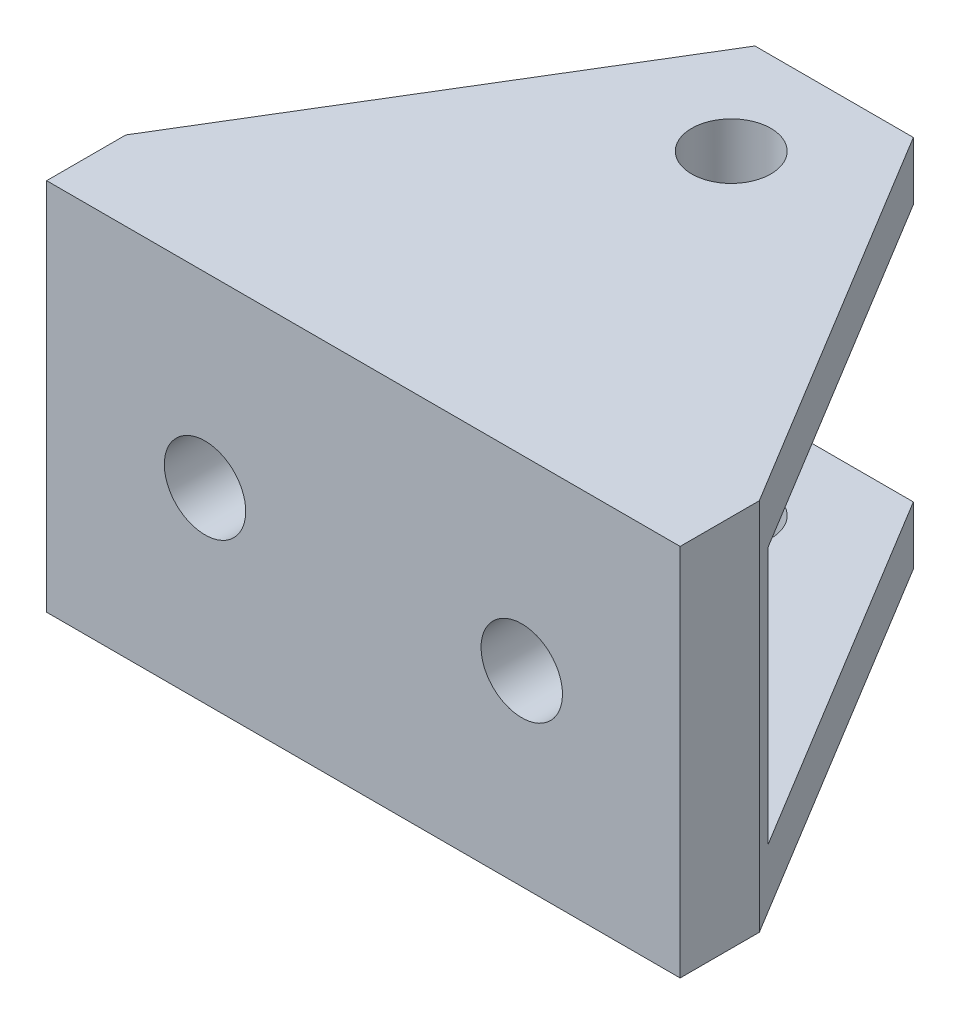
from build123d import *

# Parameters (mm, degrees)
BOSS_EXTRUDE1_DEPTH                                  = 50.8
CBORE_FOR_1_4_BINDING_HEAD_MACHINE_SCREW_D           = 6.5278
CBORE_FOR_1_4_BINDING_HEAD_MACHINE_SCREW_CBORE_D     = 14.2875
CBORE_FOR_1_4_BINDING_HEAD_MACHINE_SCREW_CBORE_DEPTH = 3.302
CUT_EXTRUDE1_REACH                                   = 73.186
SKETCH4_R                                            = 3.175


with BuildPart() as part:
    # Sketch1 → Boss-Extrude1 (new body)
    with BuildSketch(Plane(origin=(0, 0, 0), x_dir=(0, 0, -1), z_dir=(1, 0, 0))):
        Polygon((0, 0), (0, 29.972), (39.856315031, 29.972), (39.856315031, 25.3111), (8.106315031, 25.3111), (8.106315031, 4.6609), (39.856315031, 4.6609), (39.856315031, 0), align=None)
    extrude(amount=BOSS_EXTRUDE1_DEPTH)

    # CBORE for 1/4 Binding Head Machine Screw1 (through all)
    with Locations(Plane(origin=(0, 0, -8.106315031), x_dir=(-1, 0, 0), z_dir=(0, 0, -1))):
        with Locations((-12.7, 14.986), (-38.1, 14.986)):
            CounterBoreHole(CBORE_FOR_1_4_BINDING_HEAD_MACHINE_SCREW_D / 2, CBORE_FOR_1_4_BINDING_HEAD_MACHINE_SCREW_CBORE_D / 2, CBORE_FOR_1_4_BINDING_HEAD_MACHINE_SCREW_CBORE_DEPTH)

    # Cut-Extrude1: up to this face of the body (flat: up to its plane)
    cut_extrude1_end = Plane(part.part.faces().sort_by_distance((25.4, 29.972, -19.928157515))[0])
    # Sketch4 → Cut-Extrude1 (cut, up to the picked face)
    with BuildSketch(Plane.XZ, mode=Mode.PRIVATE) as cut_extrude1_sk1:
        with Locations(Location((25.4, -29.497789369, 0), (0, 0, 270))):
            Circle(SKETCH4_R)
    cut_extrude1_tool1 = split(extrude(cut_extrude1_sk1.sketch, amount=-CUT_EXTRUDE1_REACH, mode=Mode.PRIVATE), bisect_by=cut_extrude1_end, keep=Keep.BOTH, mode=Mode.PRIVATE)
    # Sketch4 → Cut-Extrude1 (cut, up to the picked face)
    with BuildSketch(Plane.XZ, mode=Mode.PRIVATE) as cut_extrude1_sk2:
        Polygon((0, -6.35), (19.05, -37.752789369), (31.75, -37.752789369), (50.8, -6.35), (50.8, -39.856315031), (0, -39.856315031), align=None)
    cut_extrude1_tool2 = split(extrude(cut_extrude1_sk2.sketch, amount=-CUT_EXTRUDE1_REACH, mode=Mode.PRIVATE), bisect_by=cut_extrude1_end, keep=Keep.BOTH, mode=Mode.PRIVATE)
    add(cut_extrude1_tool1.solids().sort_by(Axis((25.4, 0, -29.497789), (0, 1, 0)))[0], mode=Mode.SUBTRACT)
    add(cut_extrude1_tool2.solids().sort_by(Axis((9.004703, 0, -22.367025), (0, 1, 0)))[0], mode=Mode.SUBTRACT)


solid = part.part
